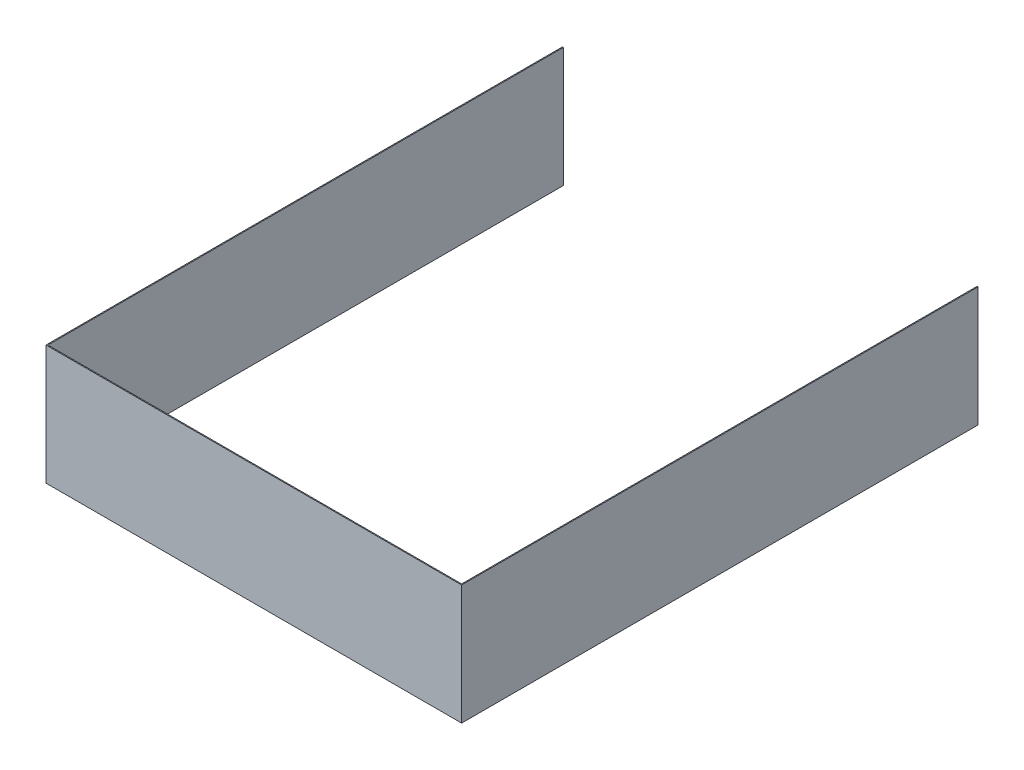
from build123d import *

# Parameters (mm, degrees)
TOPPING_PLINT_U_1_START = 10
TOPPING_PLINT_U_1_DEPTH = 190


with BuildPart() as part:
    # Sketch1 → TOPPING_plint_U_1 (new body)
    with BuildSketch(Plane(origin=(0, 0, 0), x_dir=(1, 0, 0), z_dir=(0, 1, 0)).offset(TOPPING_PLINT_U_1_START)):
        Polygon((20, 800), (20, -20), (680, -20), (680, 800), (678.5, 800), (678.5, -18.5), (21.5, -18.5), (21.5, 800), align=None)
    extrude(amount=TOPPING_PLINT_U_1_DEPTH)


solid = part.part
